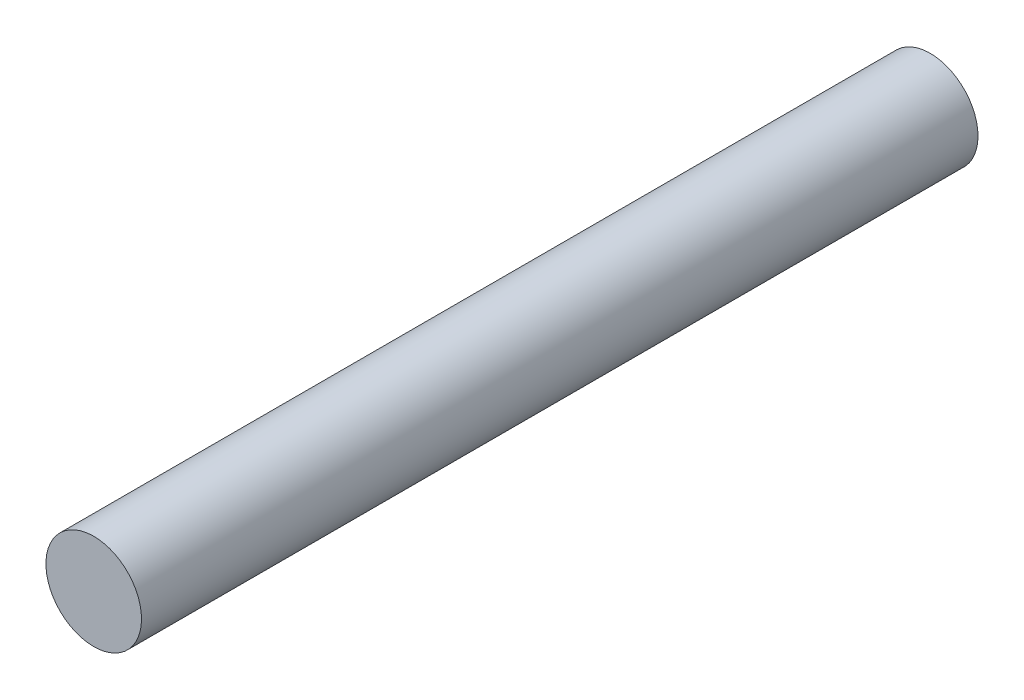
from build123d import *

# Parameters (mm, degrees)
SKETCH1_R           = 4
BOSS_EXTRUDE1_DEPTH = 70
SKETCH2_R           = 2.5
CUT_EXTRUDE1_DEPTH  = 6


with BuildPart() as part:
    # Sketch1 → Boss-Extrude1 (new body)
    with BuildSketch(Plane.XY):
        Circle(SKETCH1_R)
    extrude(amount=BOSS_EXTRUDE1_DEPTH)

    # Sketch2 → Cut-Extrude1 (cut)
    with BuildSketch(Plane(origin=(0, 0, 0), x_dir=(-1, 0, 0), z_dir=(0, 0, -1))):
        Circle(SKETCH2_R)
    extrude(amount=-CUT_EXTRUDE1_DEPTH, mode=Mode.SUBTRACT)


solid = part.part
